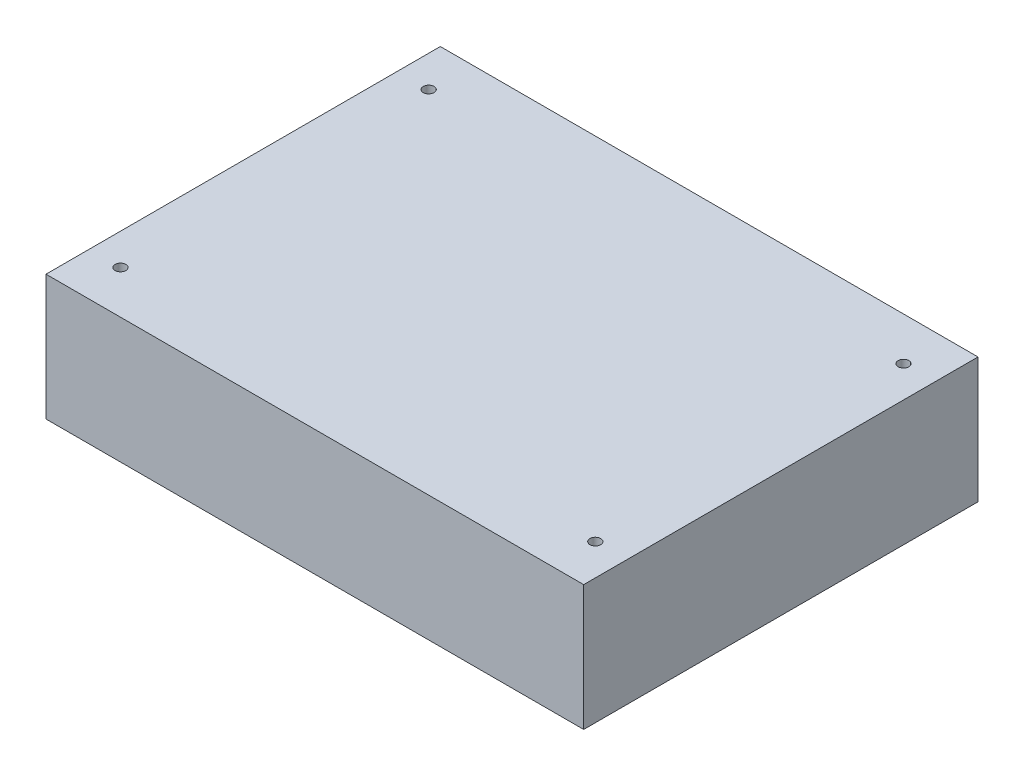
from build123d import *

# Parameters (mm, degrees)
SKETCH_1_W          = 150
SKETCH_1_H          = 110
EXTRUDE_1_DEPTH     = 35
SKETCH_2_R          = 1.5
CUT_EXTRUDE_1_DEPTH = 100.373034572


with BuildPart() as part:
    # 草图1 → 凸台-拉伸1 (new body)
    with BuildSketch(Plane(origin=(0, 0, 0), x_dir=(1, 0, 0), z_dir=(0, 1, 0))):
        Rectangle(SKETCH_1_W, SKETCH_1_H)
    extrude(amount=EXTRUDE_1_DEPTH)

    # 草图2 → 切除-拉伸1 (cut, through all)
    with BuildSketch(Plane(origin=(0, 35, 0), x_dir=(1, 0, 0), z_dir=(0, 1, 0))):
        with Locations(Location((-66.2305, 42.9895, 0), (0, 0, 270))):
            Circle(SKETCH_2_R)
        with Locations(Location((-66.2305, -42.9895, 0), (0, 0, 270))):
            Circle(SKETCH_2_R)
        with Locations(Location((66.2305, -42.9895, 0), (0, 0, 270))):
            Circle(SKETCH_2_R)
        with Locations(Location((66.2305, 42.9895, 0), (0, 0, 270))):
            Circle(SKETCH_2_R)
    extrude(amount=-CUT_EXTRUDE_1_DEPTH, mode=Mode.SUBTRACT)


solid = part.part
